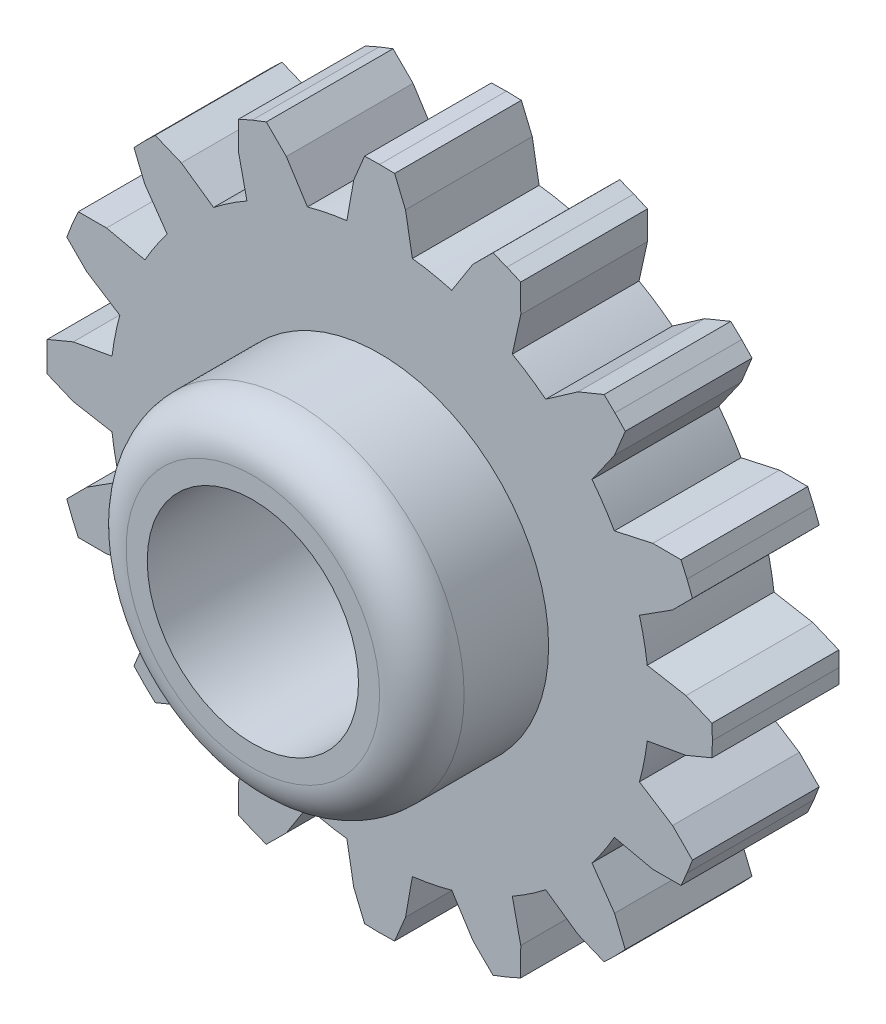
from build123d import *

# Parameters (mm, degrees)
SKETCH1_R           = 2.5
BOSS_EXTRUDE3_DEPTH = 3
SKETCH4_R           = 4
SKETCH4_R_2         = 2.5
BOSS_EXTRUDE4_DEPTH = 3
FILLET1_R           = 1
FILLET2_R           = 0.25


with BuildPart() as part:
    # Sketch1 → Boss-Extrude3 (new body)
    with BuildSketch(Plane.XY):
        with BuildLine():
            Line((-0.612376666, 7.250336436), (-0.775314301, 6.33381714))
            ThreePointArc((-0.775314301, 6.33381714), (-1.244889549, 6.258482391), (-1.707549869, 6.148383956))
            Line((-1.707549869, 6.148383956), (-2.208821365, 6.932783841))
            Line((-2.208821365, 6.932783841), (-2.682669744, 7.403979203))
            Line((-2.682669744, 7.403979203), (-3.01363203, 7.275551319))
            Line((-3.01363203, 7.275551319), (-3.338469935, 7.13233787))
            Line((-3.338469935, 7.13233787), (-3.340345901, 6.464091033))
            Line((-3.340345901, 6.464091033), (-3.140143897, 5.554984081))
            ThreePointArc((-3.140143897, 5.554984081), (-3.545145497, 5.30568518), (-3.930455051, 5.02691505))
            Line((-3.930455051, 5.02691505), (-4.693746367, 5.559777753))
            Line((-4.693746367, 5.559777753), (-5.311843844, 5.813771579))
            Line((-5.311843844, 5.813771579), (-5.568465902, 5.568465902))
            Line((-5.568465902, 5.568465902), (-5.813771579, 5.311843844))
            Line((-5.813771579, 5.311843844), (-5.559777753, 4.693746367))
            Line((-5.559777753, 4.693746367), (-5.02691505, 3.930455051))
            ThreePointArc((-5.02691505, 3.930455051), (-5.30568518, 3.545145497), (-5.554984081, 3.140143897))
            Line((-5.554984081, 3.140143897), (-6.464091033, 3.340345901))
            Line((-6.464091033, 3.340345901), (-7.13233787, 3.338469935))
            Line((-7.13233787, 3.338469935), (-7.275551319, 3.01363203))
            Line((-7.275551319, 3.01363203), (-7.403979203, 2.682669744))
            Line((-7.403979203, 2.682669744), (-6.932783841, 2.208821365))
            Line((-6.932783841, 2.208821365), (-6.148383956, 1.707549869))
            ThreePointArc((-6.148383956, 1.707549869), (-6.258482391, 1.244889549), (-6.33381714, 0.775314301))
            Line((-6.33381714, 0.775314301), (-7.250336436, 0.612376666))
            Line((-7.250336436, 0.612376666), (-7.866998111, 0.354916505))
            Line((-7.866998111, 0.354916505), (-7.875, 0))
            Line((-7.875, 0), (-7.866998111, -0.354916505))
            Line((-7.866998111, -0.354916505), (-7.250336436, -0.612376666))
            Line((-7.250336436, -0.612376666), (-6.33381714, -0.775314301))
            ThreePointArc((-6.33381714, -0.775314301), (-6.258482391, -1.244889549), (-6.148383956, -1.707549869))
            Line((-6.148383956, -1.707549869), (-6.932783841, -2.208821365))
            Line((-6.932783841, -2.208821365), (-7.403979203, -2.682669744))
            Line((-7.403979203, -2.682669744), (-7.275551319, -3.01363203))
            Line((-7.275551319, -3.01363203), (-7.13233787, -3.338469935))
            Line((-7.13233787, -3.338469935), (-6.464091033, -3.340345901))
            Line((-6.464091033, -3.340345901), (-5.554984081, -3.140143897))
            ThreePointArc((-5.554984081, -3.140143897), (-5.30568518, -3.545145497), (-5.02691505, -3.930455051))
            Line((-5.02691505, -3.930455051), (-5.559777753, -4.693746367))
            Line((-5.559777753, -4.693746367), (-5.813771579, -5.311843844))
            Line((-5.813771579, -5.311843844), (-5.568465902, -5.568465902))
            Line((-5.568465902, -5.568465902), (-5.311843844, -5.813771579))
            Line((-5.311843844, -5.813771579), (-4.693746367, -5.559777753))
            Line((-4.693746367, -5.559777753), (-3.930455051, -5.02691505))
            ThreePointArc((-3.930455051, -5.02691505), (-3.545145497, -5.30568518), (-3.140143897, -5.554984081))
            Line((-3.140143897, -5.554984081), (-3.340345901, -6.464091033))
            Line((-3.340345901, -6.464091033), (-3.338469935, -7.13233787))
            Line((-3.338469935, -7.13233787), (-3.01363203, -7.275551319))
            Line((-3.01363203, -7.275551319), (-2.682669744, -7.403979203))
            Line((-2.682669744, -7.403979203), (-2.208821365, -6.932783841))
            Line((-2.208821365, -6.932783841), (-1.707549869, -6.148383956))
            ThreePointArc((-1.707549869, -6.148383956), (-1.244889549, -6.258482391), (-0.775314301, -6.33381714))
            Line((-0.775314301, -6.33381714), (-0.612376666, -7.250336436))
            Line((-0.612376666, -7.250336436), (-0.354916505, -7.866998111))
            Line((-0.354916505, -7.866998111), (0, -7.875))
            Line((0, -7.875), (0.354916505, -7.866998111))
            Line((0.354916505, -7.866998111), (0.612376666, -7.250336436))
            Line((0.612376666, -7.250336436), (0.775314301, -6.33381714))
            ThreePointArc((0.775314301, -6.33381714), (1.244889549, -6.258482391), (1.707549869, -6.148383956))
            Line((1.707549869, -6.148383956), (2.208821365, -6.932783841))
            Line((2.208821365, -6.932783841), (2.682669744, -7.403979203))
            Line((2.682669744, -7.403979203), (3.01363203, -7.275551319))
            Line((3.01363203, -7.275551319), (3.338469935, -7.13233787))
            Line((3.338469935, -7.13233787), (3.340345901, -6.464091033))
            Line((3.340345901, -6.464091033), (3.140143897, -5.554984081))
            ThreePointArc((3.140143897, -5.554984081), (3.545145497, -5.30568518), (3.930455051, -5.02691505))
            Line((3.930455051, -5.02691505), (4.693746367, -5.559777753))
            Line((4.693746367, -5.559777753), (5.311843844, -5.813771579))
            Line((5.311843844, -5.813771579), (5.568465902, -5.568465902))
            Line((5.568465902, -5.568465902), (5.813771579, -5.311843844))
            Line((5.813771579, -5.311843844), (5.559777753, -4.693746367))
            Line((5.559777753, -4.693746367), (5.02691505, -3.930455051))
            ThreePointArc((5.02691505, -3.930455051), (5.30568518, -3.545145497), (5.554984081, -3.140143897))
            Line((5.554984081, -3.140143897), (6.464091033, -3.340345901))
            Line((6.464091033, -3.340345901), (7.13233787, -3.338469935))
            Line((7.13233787, -3.338469935), (7.275551319, -3.01363203))
            Line((7.275551319, -3.01363203), (7.403979203, -2.682669744))
            Line((7.403979203, -2.682669744), (6.932783841, -2.208821365))
            Line((6.932783841, -2.208821365), (6.148383956, -1.707549869))
            ThreePointArc((6.148383956, -1.707549869), (6.258482391, -1.244889549), (6.33381714, -0.775314301))
            Line((6.33381714, -0.775314301), (7.250336436, -0.612376666))
            Line((7.250336436, -0.612376666), (7.866998111, -0.354916505))
            Line((7.866998111, -0.354916505), (7.875, 0))
            Line((7.875, 0), (7.866998111, 0.354916505))
            Line((7.866998111, 0.354916505), (7.250336436, 0.612376666))
            Line((7.250336436, 0.612376666), (6.33381714, 0.775314301))
            ThreePointArc((6.33381714, 0.775314301), (6.258482391, 1.244889549), (6.148383956, 1.707549869))
            Line((6.148383956, 1.707549869), (6.932783841, 2.208821365))
            Line((6.932783841, 2.208821365), (7.403979203, 2.682669744))
            Line((7.403979203, 2.682669744), (7.275551319, 3.01363203))
            Line((7.275551319, 3.01363203), (7.13233787, 3.338469935))
            Line((7.13233787, 3.338469935), (6.464091033, 3.340345901))
            Line((6.464091033, 3.340345901), (5.554984081, 3.140143897))
            ThreePointArc((5.554984081, 3.140143897), (5.30568518, 3.545145497), (5.02691505, 3.930455051))
            Line((5.02691505, 3.930455051), (5.559777753, 4.693746367))
            Line((5.559777753, 4.693746367), (5.813771579, 5.311843844))
            Line((5.813771579, 5.311843844), (5.568465902, 5.568465902))
            Line((5.568465902, 5.568465902), (5.311843844, 5.813771579))
            Line((5.311843844, 5.813771579), (4.693746367, 5.559777753))
            Line((4.693746367, 5.559777753), (3.930455051, 5.02691505))
            ThreePointArc((3.930455051, 5.02691505), (3.545145497, 5.30568518), (3.140143897, 5.554984081))
            Line((3.140143897, 5.554984081), (3.340345901, 6.464091033))
            Line((3.340345901, 6.464091033), (3.338469935, 7.13233787))
            Line((3.338469935, 7.13233787), (3.01363203, 7.275551319))
            Line((3.01363203, 7.275551319), (2.682669744, 7.403979203))
            Line((2.682669744, 7.403979203), (2.208821365, 6.932783841))
            Line((2.208821365, 6.932783841), (1.707549869, 6.148383956))
            ThreePointArc((1.707549869, 6.148383956), (1.244889549, 6.258482391), (0.775314301, 6.33381714))
            Line((0.775314301, 6.33381714), (0.612376666, 7.250336436))
            Line((0.612376666, 7.250336436), (0.354916505, 7.866998111))
            Line((0.354916505, 7.866998111), (0, 7.875))
            Line((0, 7.875), (-0.354916505, 7.866998111))
            Line((-0.354916505, 7.866998111), (-0.612376666, 7.250336436))
        make_face()
        Circle(SKETCH1_R, mode=Mode.SUBTRACT)
    extrude(amount=BOSS_EXTRUDE3_DEPTH)

    # Sketch4 → Boss-Extrude4 (add)
    with BuildSketch(Plane.XY.offset(3)):
        Circle(SKETCH4_R)
        Circle(SKETCH4_R_2, mode=Mode.SUBTRACT)
    extrude(amount=BOSS_EXTRUDE4_DEPTH)

    # Fillet1
    fillet1_edges = [part.edges().sort_by_distance(p)[0] for p in [
        (-4, 0, 6),
    ]]
    fillet(fillet1_edges, radius=FILLET1_R)

    # Fillet2
    fillet2_edges = [part.edges().sort_by_distance(p)[0] for p in [
        (-2.5, 0, 0),
    ]]
    fillet(fillet2_edges, radius=FILLET2_R)


solid = part.part
